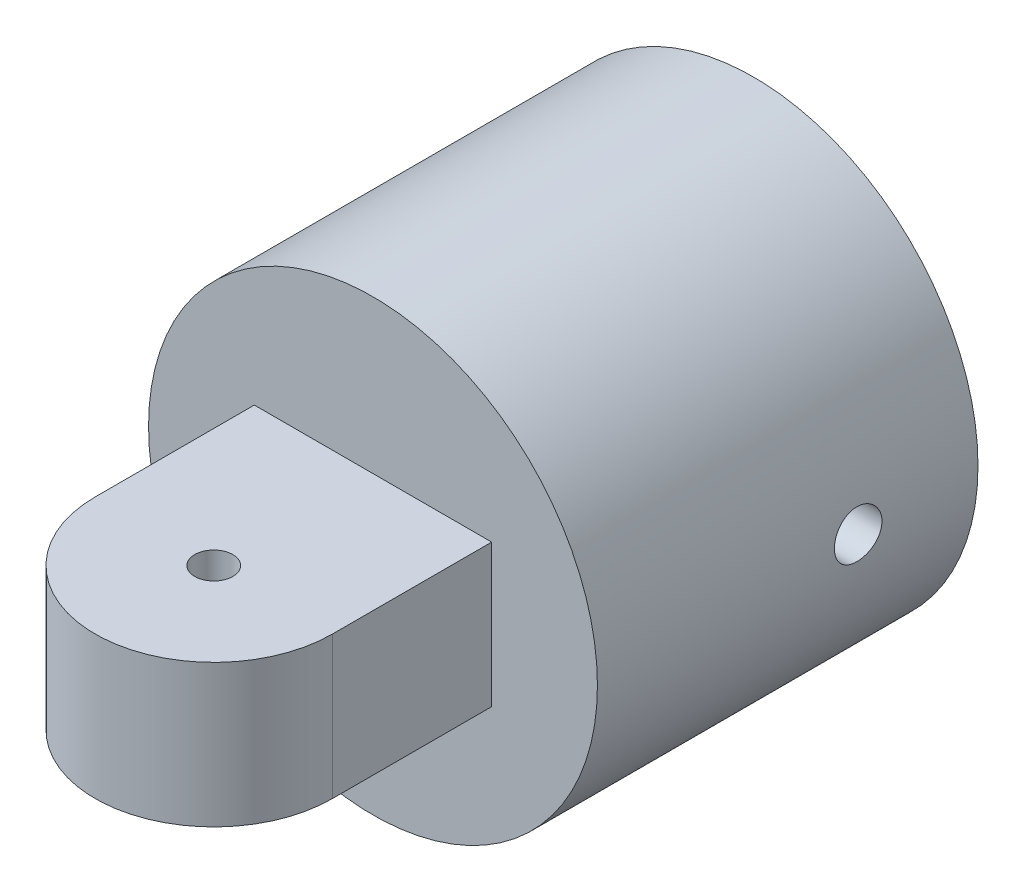
from build123d import *

# Parameters (mm, degrees)
RESSALTO_EXTRUS_O1_DEPTH      = 30
RESSALTO_EXTRUS_O1_DEPTH_BACK = 10
ESBO_O1_R                     = 23.59
RESSALTO_EXTRUS_O2_DEPTH      = 7.49
ESBO_O3_R                     = 2
CORTE_EXTRUS_O1_DEPTH         = 37.5
ESBO_O4_R                     = 2.5
CORTE_EXTRUS_O2_DEPTH         = 80


with BuildPart() as part:
    # Esboço1 → Ressalto-extrusão1 (new, two sides: drawn at the far end of the back side and taken through both)
    with BuildSketch(Plane.XY.offset(-RESSALTO_EXTRUS_O1_DEPTH_BACK)):
        Circle(ESBO_O1_R)
    extrude(amount=RESSALTO_EXTRUS_O1_DEPTH + RESSALTO_EXTRUS_O1_DEPTH_BACK)

    # Esboço4 → Corte-extrusão2 (cut, symmetric)
    with BuildSketch(Plane.ZY.offset(22.473507345)):
        with Locations((2.59265528, 0)):
            Circle(ESBO_O4_R)
    extrude(amount=CORTE_EXTRUS_O2_DEPTH, both=True, mode=Mode.SUBTRACT)


with BuildPart() as body_2:
    # Esboço2 → Ressalto-extrusão2 (new, symmetric)
    with BuildSketch(Plane(origin=(0, 0, 0), x_dir=(1, 0, 0), z_dir=(0, 1, 0))):
        with BuildLine():
            Line((-12.473507345, -30), (12.473507345, -30))
            Line((12.473507345, -30), (12.473507345, -46.734725635))
            ThreePointArc((12.473507345, -46.734725635), (0, -59.20823298), (-12.473507345, -46.734725635))
            Line((-12.473507345, -46.734725635), (-12.473507345, -30))
        make_face()
    extrude(amount=RESSALTO_EXTRUS_O2_DEPTH, both=True)

    # Esboço3 → Corte-extrusão1 (cut, symmetric)
    with BuildSketch(Plane(origin=(0, 7.49, 0), x_dir=(1, 0, 0), z_dir=(0, 1, 0))):
        with Locations(Location((0, -46.734725635, 0), (0, 0, 270))):
            Circle(ESBO_O3_R)
    extrude(amount=CORTE_EXTRUS_O1_DEPTH, both=True, mode=Mode.SUBTRACT)


solid = Compound([part.part, body_2.part])
